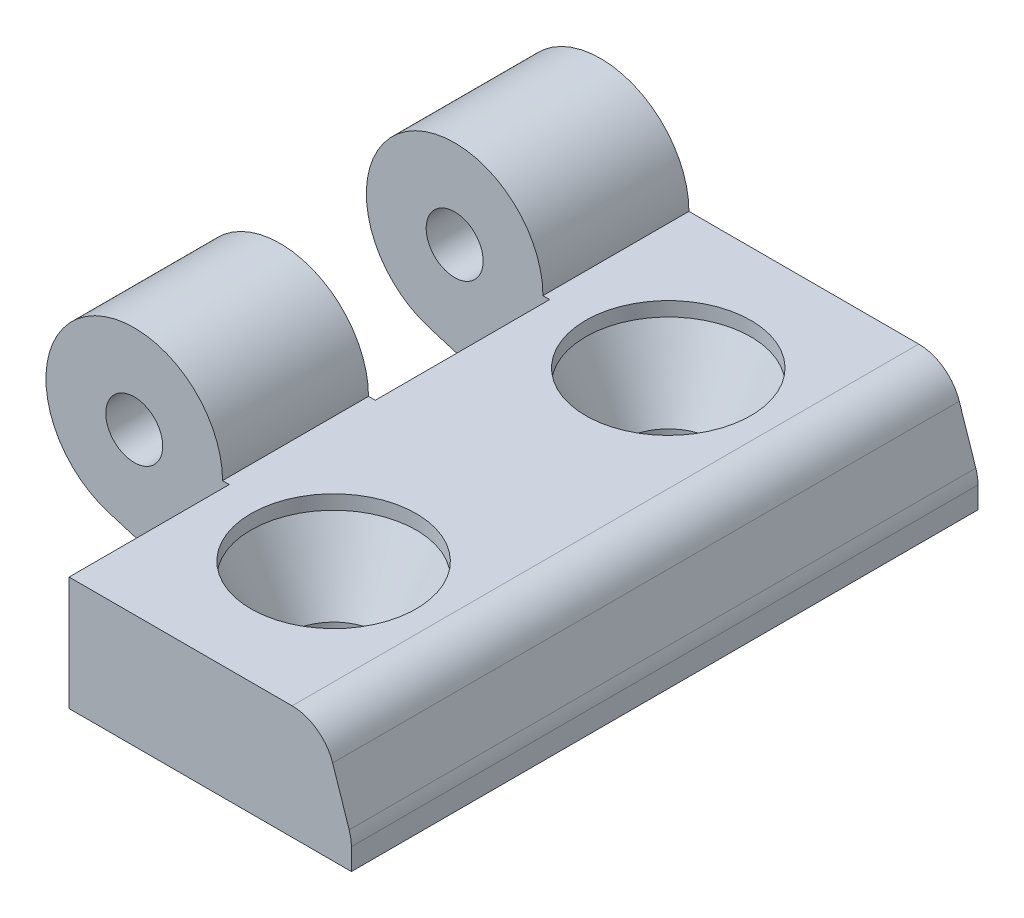
from build123d import *

# Parameters (mm, degrees)
EXTRUDE_1_DEPTH          = 22
CUT_EXTRUDE_1_DEPTH      = 36.358874416
CUT_EXTRUDE_1_DEPTH_BACK = 36.358874416
SKETCH_3_W               = 15.710666492
SKETCH_3_H               = 11.25
SKETCH_3_W_2             = 17.010469835
SKETCH_3_H_2             = 12.25
SKETCH_4_R               = 2
CUT_EXTRUDE_2_DEPTH      = 52.983170353
PATTERN_LINEAR_1_COUNT   = 2
PATTERN_LINEAR_1_PITCH   = 23.5


with BuildPart() as part:
    # 草图1 → 凸台-拉伸1 (new, symmetric)
    with BuildSketch(Plane.XY):
        with BuildLine():
            Line((26.5, -8), (26.5, -6.486832981))
            ThreePointArc((26.5, -6.486832981), (26.461262373, -6.006286251), (26.346049894, -5.538149682))
            Line((26.346049894, -5.538149682), (25.183772234, -2.051316702))
            ThreePointArc((25.183772234, -2.051316702), (24.091853194, -0.566273444), (22.33772234, 0))
            Line((22.33772234, 0), (6.2, 0))
            ThreePointArc((6.2, 0), (-3.691899698, 4.980951377), (-1.803186005, -5.931991253))
            Line((-1.803186005, -5.931991253), (5, -8))
            Line((5, -8), (26.5, -8))
        make_face()
    extrude(amount=EXTRUDE_1_DEPTH, both=True)

    # 草图3 → 切除-拉伸1 (cut, two sides: drawn at the far end of the back side and taken through both)
    with BuildSketch(Plane(origin=(0, 0, 0), x_dir=(1, 0, 0), z_dir=(0, 1, 0)).offset(-CUT_EXTRUDE_1_DEPTH_BACK)):
        with Locations((-1.180894358, -16.375)):
            Rectangle(SKETCH_3_W, SKETCH_3_H)
        with Locations((-1.83079603, 5.625)):
            Rectangle(SKETCH_3_W_2, SKETCH_3_H_2)
    extrude(amount=CUT_EXTRUDE_1_DEPTH + CUT_EXTRUDE_1_DEPTH_BACK, mode=Mode.SUBTRACT)

    # 草图4 → 切除-拉伸2 (cut, through all)
    with BuildSketch(Plane(origin=(0, 0, -22), x_dir=(-1, 0, 0), z_dir=(0, 0, -1))):
        Circle(SKETCH_4_R)
    extrude(amount=-CUT_EXTRUDE_2_DEPTH, mode=Mode.SUBTRACT)

    # 草图5 → 切除-旋转1 (revolve, cut)
    with BuildSketch(Plane(origin=(0, 0, -11.75), x_dir=(-1, 0, 0), z_dir=(0, 0, -1))):
        Polygon((-15, 0), (-15, -8), (-11.75, -8), (-11.75, -6), (-9.2, -1), (-9.2, 0), align=None)
    cut_revolve_1 = revolve(axis=Axis((15, 0, -11.75), (0, -1, 0)), mode=Mode.SUBTRACT)

    # 阵列(线性)1: 切除-旋转1 ×2
    with Locations(*[(0, 0, i * PATTERN_LINEAR_1_PITCH) for i in range(1, PATTERN_LINEAR_1_COUNT)]):
        add(cut_revolve_1, mode=Mode.SUBTRACT)


solid = part.part
